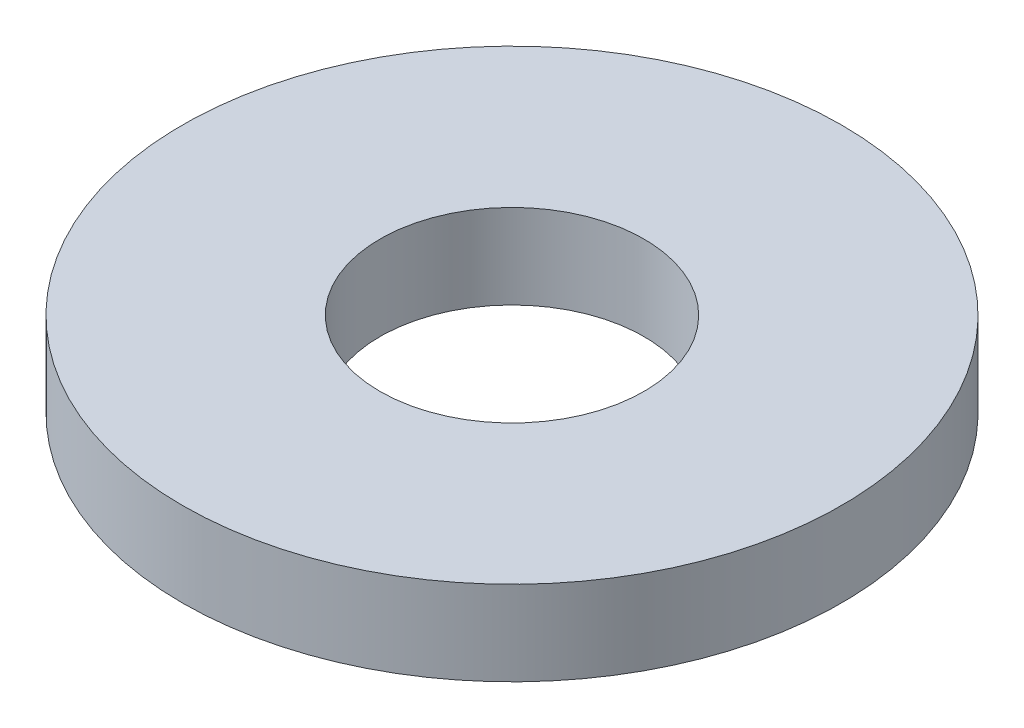
from build123d import *

# Parameters (mm, degrees)
SKETCH1_R           = 3.9624
BOSS_EXTRUDE1_DEPTH = 1.016
SKETCH5_R           = 1.5875
CUT_EXTRUDE1_DEPTH  = 6.695040256


with BuildPart() as part:
    # Sketch1 → Boss-Extrude1 (new body)
    with BuildSketch(Plane(origin=(0, 0, 0), x_dir=(1, 0, 0), z_dir=(0, 1, 0))):
        with Locations(Location((0, 0, 0), (0, 0, 270))):
            Circle(SKETCH1_R)
    extrude(amount=BOSS_EXTRUDE1_DEPTH)

    # Sketch5 → Cut-Extrude1 (cut, through all)
    with BuildSketch(Plane(origin=(0, 1.016, 0), x_dir=(-1, 0, 0), z_dir=(0, 1, 0))):
        with Locations(Location((0, 0, 0), (0, 0, 90))):
            Circle(SKETCH5_R)
    extrude(amount=-CUT_EXTRUDE1_DEPTH, mode=Mode.SUBTRACT)


solid = part.part
